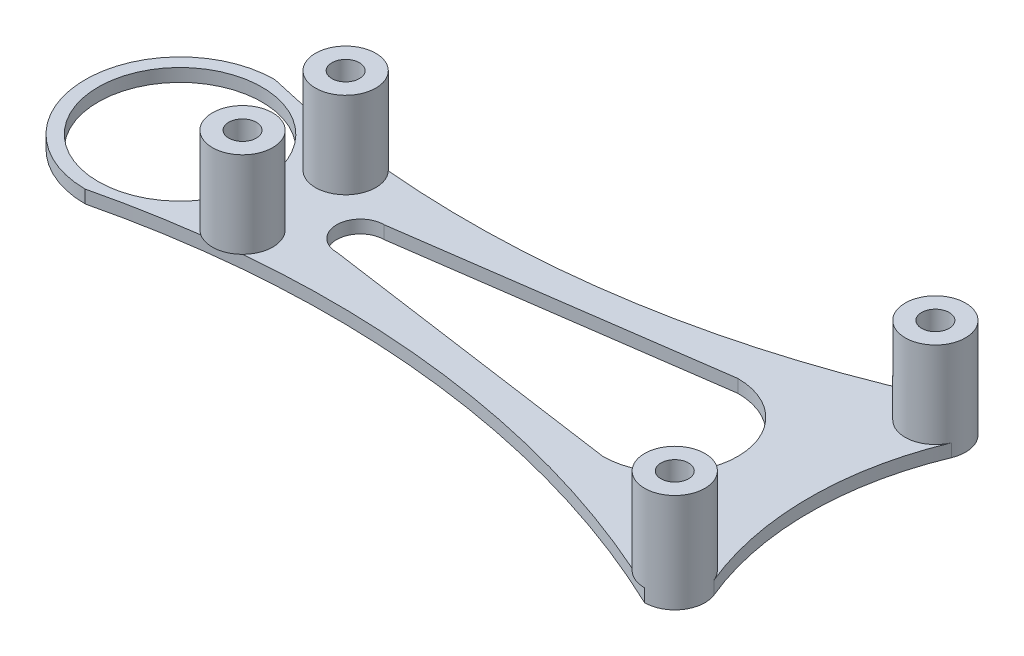
from build123d import *
from build123d.topology import SkipClean

# Parameters (mm, degrees)
ESBO_O1_R                = 1.6
RESSALTO_EXTRUS_O1_DEPTH = 0.75
CORTE_EXTRUS_O1_REACH    = 123.445
ESBO_O2_R                = 9.5
ESBO_O3_R                = 3.5
ESBO_O3_R_2              = 1.6
RESSALTO_EXTRUS_O2_DEPTH = 10


with BuildPart() as part:
    # Esboço1 → Ressalto-extrusão1 (new, symmetric)
    with BuildSketch(Plane(origin=(0, 0, 0), x_dir=(1, 0, 0), z_dir=(0, 1, 0))):
        with BuildLine():
            ThreePointArc((-33.25966317, 13.776603565), (-36, 0), (-33.25966317, -13.776603565))
            ThreePointArc((-33.25966317, -13.776603565), (-33.583097891, -17.060491394), (-36.493241534, -18.615995578))
            ThreePointArc((-36.493241534, -18.615995578), (-72.090991916, -8.566197582), (-109, -11))
            ThreePointArc((-109, -11), (-120, 0), (-109, 11))
            ThreePointArc((-109, 11), (-72.090991916, 8.566197582), (-36.493241534, 18.615995578))
            ThreePointArc((-36.493241534, 18.615995578), (-33.583097891, 17.060491394), (-33.25966317, 13.776603565))
        make_face()
        with Locations(Location((-36.493241534, 15.115995578, 0), (0, 0, 270))):
            Circle(ESBO_O1_R, mode=Mode.SUBTRACT)
        with Locations(Location((-36.493241534, -15.115995578, 0), (0, 0, 270))):
            Circle(ESBO_O1_R, mode=Mode.SUBTRACT)
        with Locations(Location((-95.79, 6, 0), (0, 0, 270))):
            Circle(ESBO_O1_R, mode=Mode.SUBTRACT)
        with Locations(Location((-95.79, -5.96, 0), (0, 0, 270))):
            Circle(ESBO_O1_R, mode=Mode.SUBTRACT)
    extrude(amount=RESSALTO_EXTRUS_O1_DEPTH, both=True)

    # Esboço2 → Corte-extrusão1 (cut, up to next)
    with BuildSketch(Plane(origin=(0, 0.75, 0), x_dir=(1, 0, 0), z_dir=(0, 1, 0)), mode=Mode.PRIVATE) as corte_extrus_o1_sk1:
        with Locations(Location((-109, 0, 0), (0, 0, 270))):
            Circle(ESBO_O2_R)
    corte_extrus_o1_tool1 = extrude(corte_extrus_o1_sk1.sketch, amount=-CORTE_EXTRUS_O1_REACH, mode=Mode.PRIVATE) & part.part
    # Esboço2 → Corte-extrusão1 (cut, up to next)
    with BuildSketch(Plane(origin=(0, 0.75, 0), x_dir=(1, 0, 0), z_dir=(0, 1, 0)), mode=Mode.PRIVATE) as corte_extrus_o1_sk2:
        with BuildLine():
            Line((-88.078445949, 2.757577424), (-52.119636338, 7.831519885))
            ThreePointArc((-52.119636338, 7.831519885), (-44.288116453, 0), (-52.119636338, -7.831519885))
            Line((-52.119636338, -7.831519885), (-88.078445949, -2.757577424))
            ThreePointArc((-88.078445949, -2.757577424), (-90.836023373, 0), (-88.078445949, 2.757577424))
        make_face()
    corte_extrus_o1_tool2 = extrude(corte_extrus_o1_sk2.sketch, amount=-CORTE_EXTRUS_O1_REACH, mode=Mode.PRIVATE) & part.part
    add(corte_extrus_o1_tool1.solids().sort_by_distance((-109, 0.75, 0))[0], mode=Mode.SUBTRACT)
    add(corte_extrus_o1_tool2.solids().sort_by_distance((-64.134293, 0.75, 0))[0], mode=Mode.SUBTRACT)

    # Esboço3 → Ressalto-extrusão2 (add)
    # profile 1 of 4: a face of its own
    with SkipClean():  # the faces are left unmerged after this step: merging them gives an invalid solid
        with BuildSketch(Plane(origin=(0, 0.75, 0), x_dir=(1, 0, 0), z_dir=(0, 1, 0))):
            with Locations(Location((-36.493241534, 15.115995578, 0), (0, 0, 90))):
                Circle(ESBO_O3_R)
            with Locations(Location((-36.493241534, 15.115995578, 0), (0, 0, 270))):
                Circle(ESBO_O3_R_2, mode=Mode.SUBTRACT)
        # profile 2 of 4: a face of its own
        with BuildSketch(Plane(origin=(0, 0.75, 0), x_dir=(1, 0, 0), z_dir=(0, 1, 0))):
            with Locations(Location((-36.493241534, -15.115995578, 0), (0, 0, 270))):
                Circle(ESBO_O3_R)
            with Locations(Location((-36.493241534, -15.115995578, 0), (0, 0, 270))):
                Circle(ESBO_O3_R_2, mode=Mode.SUBTRACT)
        # profile 3 of 4: a face of its own
        with BuildSketch(Plane(origin=(0, 0.75, 0), x_dir=(1, 0, 0), z_dir=(0, 1, 0))):
            with Locations(Location((-95.79, -5.96, 0), (0, 0, 315.511564989))):
                Circle(ESBO_O3_R)
            with Locations(Location((-95.79, -5.96, 0), (0, 0, 270))):
                Circle(ESBO_O3_R_2, mode=Mode.SUBTRACT)
        # profile 4 of 4: a face of its own
        with BuildSketch(Plane(origin=(0, 0.75, 0), x_dir=(1, 0, 0), z_dir=(0, 1, 0))):
            with Locations(Location((-95.79, 6, 0), (0, 0, 123.846033528))):
                Circle(ESBO_O3_R)
            with Locations(Location((-95.79, 6, 0), (0, 0, 270))):
                Circle(ESBO_O3_R_2, mode=Mode.SUBTRACT)
        extrude(amount=RESSALTO_EXTRUS_O2_DEPTH)


solid = part.part
